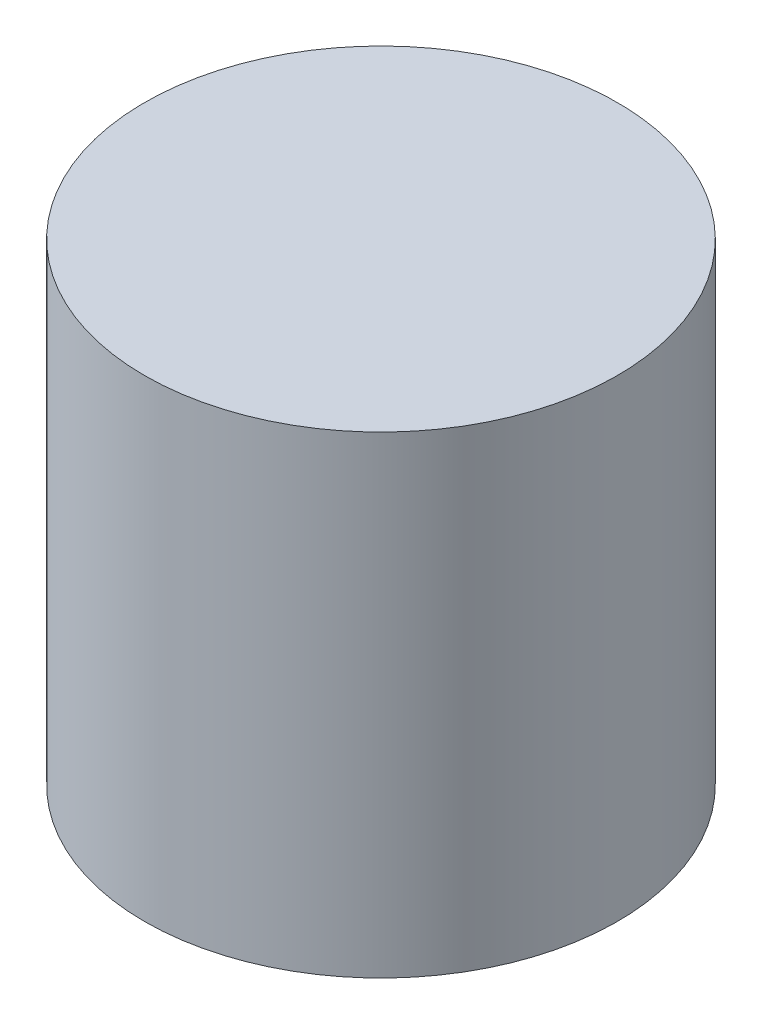
from build123d import *

# Parameters (mm, degrees)
SKETCH1_R           = 2
SKETCH1_R_2         = 0.925
BOSS_EXTRUDE1_DEPTH = 3
SKETCH2_R           = 2
BOSS_EXTRUDE2_DEPTH = 1


with BuildPart() as part:
    # Sketch1 → Boss-Extrude1 (new body)
    with BuildSketch(Plane(origin=(0, 0, 0), x_dir=(1, 0, 0), z_dir=(0, 1, 0))):
        with Locations(Location((0, 0, 0), (0, 0, 270))):
            Circle(SKETCH1_R)
        with Locations(Location((0, 0, 0), (0, 0, 270))):
            Circle(SKETCH1_R_2, mode=Mode.SUBTRACT)
    extrude(amount=BOSS_EXTRUDE1_DEPTH)

    # Sketch2 → Boss-Extrude2 (add)
    with BuildSketch(Plane(origin=(0, 3, 0), x_dir=(1, 0, 0), z_dir=(0, 1, 0))):
        with Locations(Location((0, 0, 0), (0, 0, 270))):
            Circle(SKETCH2_R)
    extrude(amount=BOSS_EXTRUDE2_DEPTH)


solid = part.part
